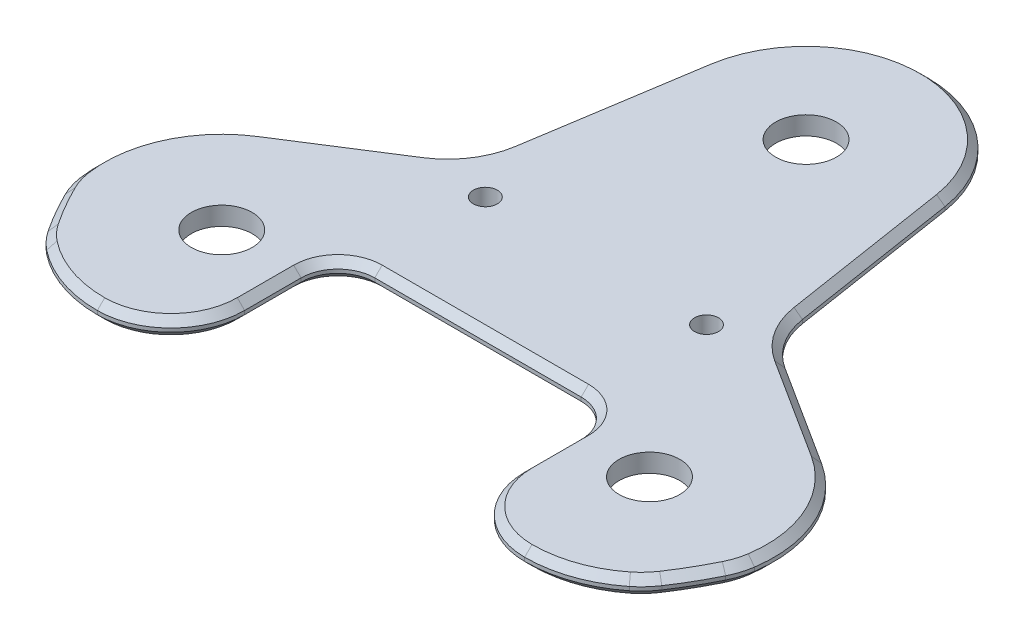
from build123d import *

# Parameters (mm, degrees)
SKETCH1_R           = 1.625
BOSS_EXTRUDE1_DEPTH = 2.5
FILLET1_R           = 5
SKETCH3_R           = 4.125
CUT_EXTRUDE2_DEPTH  = 71.75485849
CUT_EXTRUDE3_DEPTH  = 71.75485849
FILLET2_R           = 10
CHAMFER1_SIZE       = 1


with BuildPart() as part:
    # Sketch1 → Boss-Extrude1 (new body)
    with BuildSketch(Plane(origin=(0, 0, 0), x_dir=(1, 0, 0), z_dir=(0, 1, 0))):
        with BuildLine():
            ThreePointArc((50, 0), (-27.838821814, 41.533119315), (-19, -46.249324319))
            Line((-19, -46.249324319), (-19, -11))
            Line((-19, -11), (19, -11))
            Line((19, -11), (19, -46.249324319))
            ThreePointArc((19, -46.249324319), (41.533119315, -27.838821814), (50, 0))
        make_face()
        with Locations(Location((-15, 5, 0), (0, 0, 270))):
            Circle(SKETCH1_R, mode=Mode.SUBTRACT)
        with Locations(Location((15, 5, 0), (0, 0, 270))):
            Circle(SKETCH1_R, mode=Mode.SUBTRACT)
    extrude(amount=BOSS_EXTRUDE1_DEPTH)

    # Fillet1
    fillet1_edges = [part.edges().sort_by_distance(p)[0] for p in [
        (19, 1.25, 46.249324319),
        (19, 1.25, 11),
        (-19, 1.25, 11),
        (-19, 1.25, 46.249324319),
    ]]
    fillet(fillet1_edges, radius=FILLET1_R)

    # Sketch3 → Cut-Extrude2 (cut, through all)
    with BuildSketch(Plane(origin=(0, 2.5, 0), x_dir=(1, 0, 0), z_dir=(0, 1, 0))):
        with Locations(Location((0, 33.5, 0), (0, 0, 270))):
            Circle(SKETCH3_R)
        with Locations(Location((29.011851027, -16.75, 0), (0, 0, 270))):
            Circle(SKETCH3_R)
        with Locations(Location((-29.011851027, -16.75, 0), (0, 0, 270))):
            Circle(SKETCH3_R)
    extrude(amount=-CUT_EXTRUDE2_DEPTH, mode=Mode.SUBTRACT)

    # Sketch4 → Cut-Extrude3 (cut, through all)
    with BuildSketch(Plane(origin=(0, 2.5, 0), x_dir=(1, 0, 0), z_dir=(0, 1, 0))):
        with BuildLine():
            ThreePointArc((-19, -30.369481935), (-30.236455629, -33.609056698), (-40.88679997, -28.779673178))
            ThreePointArc((-40.88679997, -28.779673178), (-34.446124239, -36.241751129), (-26.666666667, -42.295258468))
            ThreePointArc((-26.666666667, -42.295258468), (-21.584770542, -42.4437078), (-19, -38.065732621))
            Line((-19, -38.065732621), (-19, -30.369481935))
        make_face()
        with BuildLine():
            Line((19, -30.369481935), (19, -38.065732621))
            ThreePointArc((19, -38.065732621), (21.584770542, -42.4437078), (26.666666667, -42.295258468))
            ThreePointArc((26.666666667, -42.295258468), (34.446124239, -36.241751129), (40.88679997, -28.779673178))
            ThreePointArc((40.88679997, -28.779673178), (30.236455629, -33.609056698), (19, -30.369481935))
        make_face()
        with BuildLine():
            ThreePointArc((-6.8e-08, 50), (-42.136436408, 26.916922685), (-45.36732807, -21.019170864))
            ThreePointArc((-45.36732807, -21.019170864), (-44.746417351, -10.573360804), (-38.095485584, -2.49464899))
            Line((-38.095485584, -2.49464899), (-20.59178284, 8.658863751))
            Line((-20.59178284, 8.658863751), (-16.301275801, 36.053117163))
            ThreePointArc((-16.301275801, 36.053117163), (-10.7266856, 46.037472474), (-6.8e-08, 50))
        make_face()
        with BuildLine():
            ThreePointArc((45.36732807, -21.019170864), (42.136436371, 26.916922743), (-6.8e-08, 50))
            ThreePointArc((-6.8e-08, 50), (10.726685548, 46.037472518), (16.301275801, 36.053117163))
            Line((16.301275801, 36.053117163), (20.59178284, 8.658863751))
            Line((20.59178284, 8.658863751), (38.095485584, -2.49464899))
            ThreePointArc((38.095485584, -2.49464899), (44.746417351, -10.573360804), (45.36732807, -21.019170864))
        make_face()
    extrude(amount=-CUT_EXTRUDE3_DEPTH, mode=Mode.SUBTRACT)

    # Fillet2
    fillet2_edges = [part.edges().sort_by_distance(p)[0] for p in [
        (40.88679997, 1.25, 28.779673178),
        (-45.36732807, 1.25, 21.019170864),
        (-20.59178284, 1.25, -8.658863751),
        (45.36732807, 1.25, 21.019170864),
        (20.59178284, 1.25, -8.658863751),
        (-40.88679997, 1.25, 28.779673178),
        (-19, 1.25, 30.369481935),
        (19, 1.25, 30.369481935),
    ]]
    fillet(fillet2_edges, radius=FILLET2_R)

    # Chamfer1
    chamfer1_edges = [part.edges().sort_by_distance(p)[0] for p in [
        (-44.388404549, 2.5, 9.729383862),
        (-18.097260259, 2.5, -24.5860218),
        (-44.388404549, 0, 9.729383862),
        (-18.097260259, 0, -24.5860218),
        (-43.301270189, 2.5, 25),
        (-43.301270189, 0, 25),
        (-34.559008869, 2.5, 32.717356984),
        (-19, 2.5, 19.826732149),
        (34.559008869, 2.5, 32.717356984),
        (43.301270189, 2.5, 25),
        (44.388404549, 2.5, 9.729383862),
        (31.247232254, 2.5, -1.86911803),
        (-31.247232254, 2.5, -1.86911803),
        (21.922865426, 2.5, 30.718460138),
        (-21.922865426, 2.5, 30.718460138),
        (40.660570606, 2.5, 28.929698969),
        (45.384139534, 2.5, 20.748237593),
        (-45.384139534, 2.5, 20.748237593),
        (-40.660570606, 2.5, 28.929698969),
        (-34.559008869, 0, 32.717356984),
        (-31.247232254, 0, -1.86911803),
        (31.247232254, 0, -1.86911803),
        (44.388404549, 0, 9.729383862),
        (43.301270189, 0, 25),
        (34.559008869, 0, 32.717356984),
        (-19, 0, 19.826732149),
        (21.922865426, 0, 30.718460138),
        (-21.922865426, 0, 30.718460138),
        (40.660570606, 0, 28.929698969),
        (45.384139534, 0, 20.748237593),
        (-45.384139534, 0, 20.748237593),
        (-40.660570606, 0, 28.929698969),
        (21.40495945, 2.5, -9.190948509),
        (21.40495945, 0, -9.190948509),
        (-21.40495945, 2.5, -9.190948509),
        (-21.40495945, 0, -9.190948509),
        (19, 0, 19.826732149),
        (0, 0, 11),
        (19, 2.5, 19.826732149),
        (0, 2.5, 11),
        (17.535533906, 0, 12.464466094),
        (17.535533906, 2.5, 12.464466094),
        (-17.535533906, 0, 12.464466094),
        (-17.535533906, 2.5, 12.464466094),
        (18.097260259, 0, -24.5860218),
        (0, 2.5, -50),
        (0, 0, -50),
        (18.097260259, 2.5, -24.5860218),
    ]]
    chamfer(chamfer1_edges, length=CHAMFER1_SIZE)


solid = part.part
